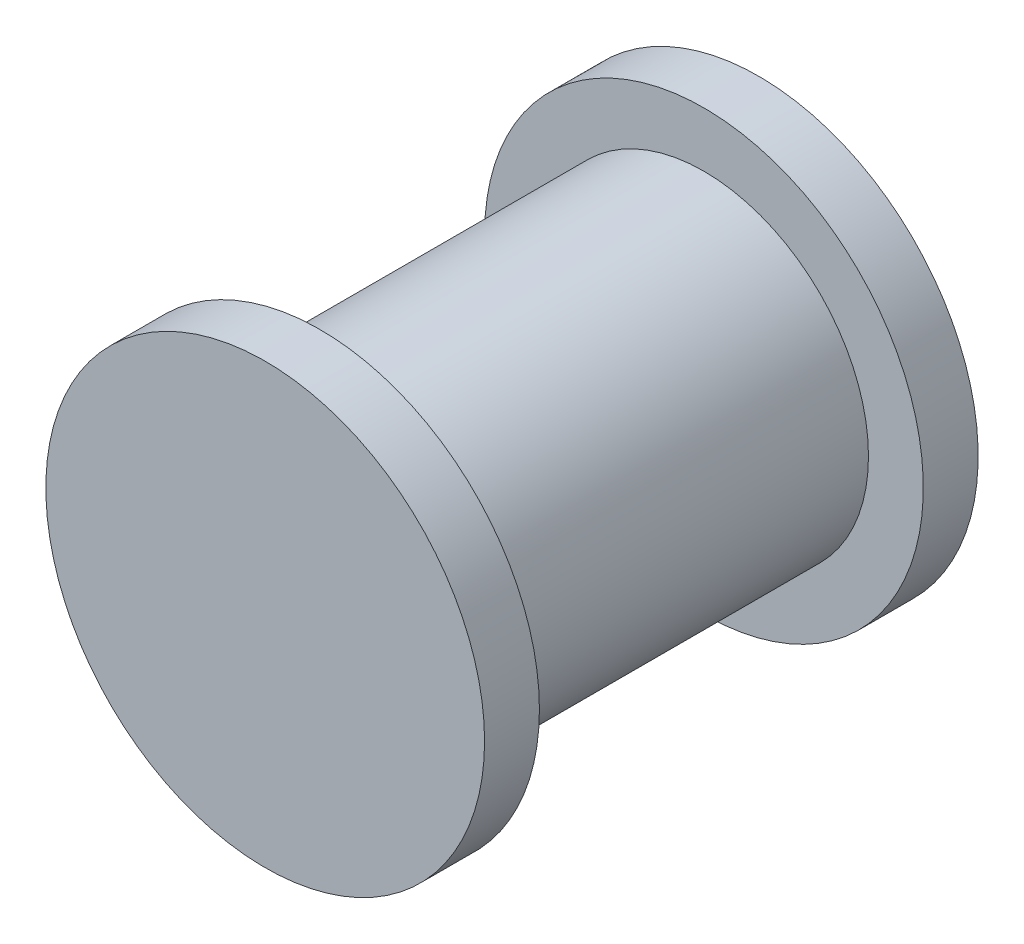
from build123d import *

# Parameters (mm, degrees)
SKETCH1_R           = 7.62
BOSS_EXTRUDE1_DEPTH = 17.78
SKETCH2_R           = 10.16
BOSS_EXTRUDE2_DEPTH = 2.54
BOSS_EXTRUDE3_START = 2.54
SKETCH3_R           = 10.16
BOSS_EXTRUDE3_DEPTH = 2.54


with BuildPart() as part:
    # Sketch1 → Boss-Extrude1 (new body)
    with BuildSketch(Plane.XY):
        Circle(SKETCH1_R)
    extrude(amount=BOSS_EXTRUDE1_DEPTH)

    # Sketch2 → Boss-Extrude2 (add)
    with BuildSketch(Plane.XY.offset(17.78)):
        Circle(SKETCH2_R)
    extrude(amount=BOSS_EXTRUDE2_DEPTH)

    # Sketch3 → Boss-Extrude3 (add)
    with BuildSketch(Plane(origin=(0, 0, 0), x_dir=(-1, 0, 0), z_dir=(0, 0, -1)).offset(BOSS_EXTRUDE3_START)):
        with Locations(Location((0, 0, 0), (0, 0, 180))):
            Circle(SKETCH3_R)
    extrude(amount=-BOSS_EXTRUDE3_DEPTH)


solid = part.part
